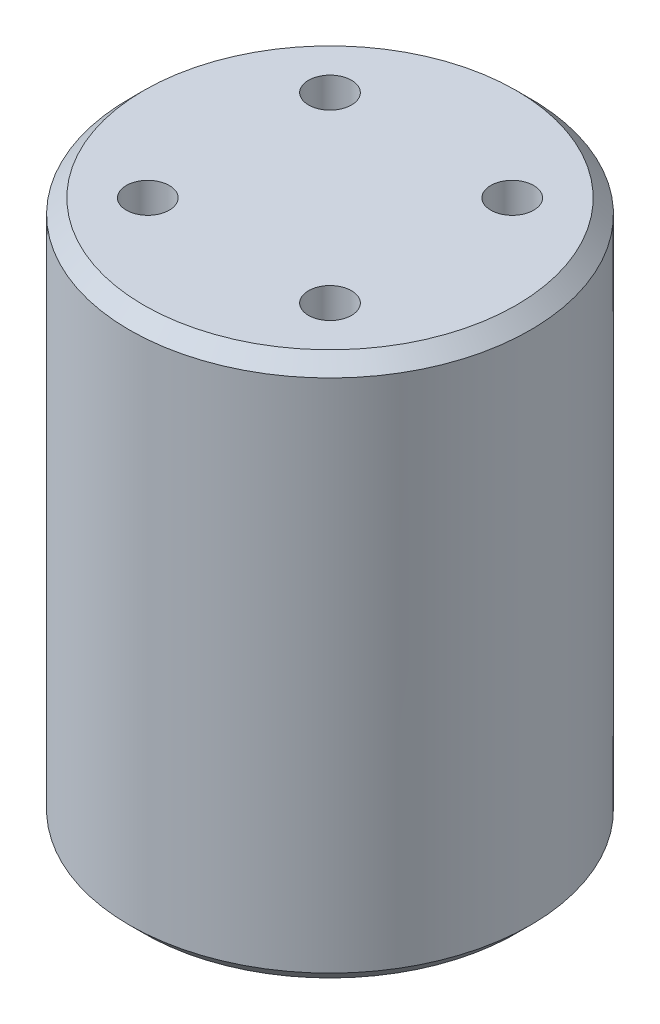
from build123d import *

# Parameters (mm, degrees)
BOSS_EXTRUDE1_DEPTH      = 28
BOSS_EXTRUDE1_DEPTH_BACK = 10
SKETCH1_R                = 14
SKETCH2_R                = 1.5
CUT_EXTRUDE1_DEPTH       = 8
CUT_EXTRUDE2_START       = -4
SKETCH3_R                = 1.5
CUT_EXTRUDE2_DEPTH       = 4
CUT_EXTRUDE3_DEPTH       = 5
SKETCH3_4_R              = 2
BOSS_EXTRUDE2_DEPTH      = 1
CHAMFER1_SIZE            = 1


with BuildPart() as part:
    # Sketch1 → Boss-Extrude1 (new, two sides: drawn at the far end of the back side and taken through both)
    with BuildSketch(Plane(origin=(0, 0, 0), x_dir=(1, 0, 0), z_dir=(0, 1, 0)).offset(-BOSS_EXTRUDE1_DEPTH_BACK)):
        Circle(SKETCH1_R)
    extrude(amount=BOSS_EXTRUDE1_DEPTH + BOSS_EXTRUDE1_DEPTH_BACK)

    # Sketch2 → Cut-Extrude1 (cut)
    with BuildSketch(Plane(origin=(0, 28, 0), x_dir=(1, 0, 0), z_dir=(0, 1, 0))):
        with Locations((-6.363961031, 6.363961031)):
            Circle(SKETCH2_R)
        with Locations((6.363961031, 6.363961031)):
            Circle(SKETCH2_R)
        with Locations((6.363961031, -6.363961031)):
            Circle(SKETCH2_R)
        with Locations((-6.363961031, -6.363961031)):
            Circle(SKETCH2_R)
    extrude(amount=-CUT_EXTRUDE1_DEPTH, mode=Mode.SUBTRACT)

    # Sketch3 → Cut-Extrude2 (cut)
    with BuildSketch(Plane.XZ.offset(10).offset(CUT_EXTRUDE2_START)):
        with Locations((-6.363961031, 6.363961031)):
            Circle(SKETCH3_R)
        with Locations((6.363961031, 6.363961031)):
            Circle(SKETCH3_R)
        with Locations((6.363961031, -6.363961031)):
            Circle(SKETCH3_R)
        with Locations((-6.363961031, -6.363961031)):
            Circle(SKETCH3_R)
    extrude(amount=CUT_EXTRUDE2_DEPTH, mode=Mode.SUBTRACT)

    # Sketch3<3> → Cut-Extrude3 (cut)
    with BuildSketch(Plane.XZ.offset(10)):
        with BuildLine():
            Line((-20.566233409, 5), (-20.566233409, -5))
            Line((-20.566233409, -5), (-8.433766591, -5))
            ThreePointArc((-8.433766591, -5), (-7.726659809, -4.707106781), (-7.433766591, -4))
            Line((-7.433766591, -4), (-7.433766591, 4))
            ThreePointArc((-7.433766591, 4), (-7.726659809, 4.707106781), (-8.433766591, 5))
            Line((-8.433766591, 5), (-20.566233409, 5))
        make_face()
    extrude(amount=-CUT_EXTRUDE3_DEPTH, mode=Mode.SUBTRACT)

    # Sketch3<4> → Boss-Extrude2 (add)
    with BuildSketch(Plane.XZ.offset(10)):
        Circle(SKETCH3_4_R)
    extrude(amount=BOSS_EXTRUDE2_DEPTH)

    # Chamfer1
    chamfer1_edges = [part.edges().sort_by_distance(p)[0] for p in [
        (-14, 28, 0),
        (2.542267135, -10, -13.767239295),
    ]]
    chamfer(chamfer1_edges, length=CHAMFER1_SIZE)


solid = part.part
